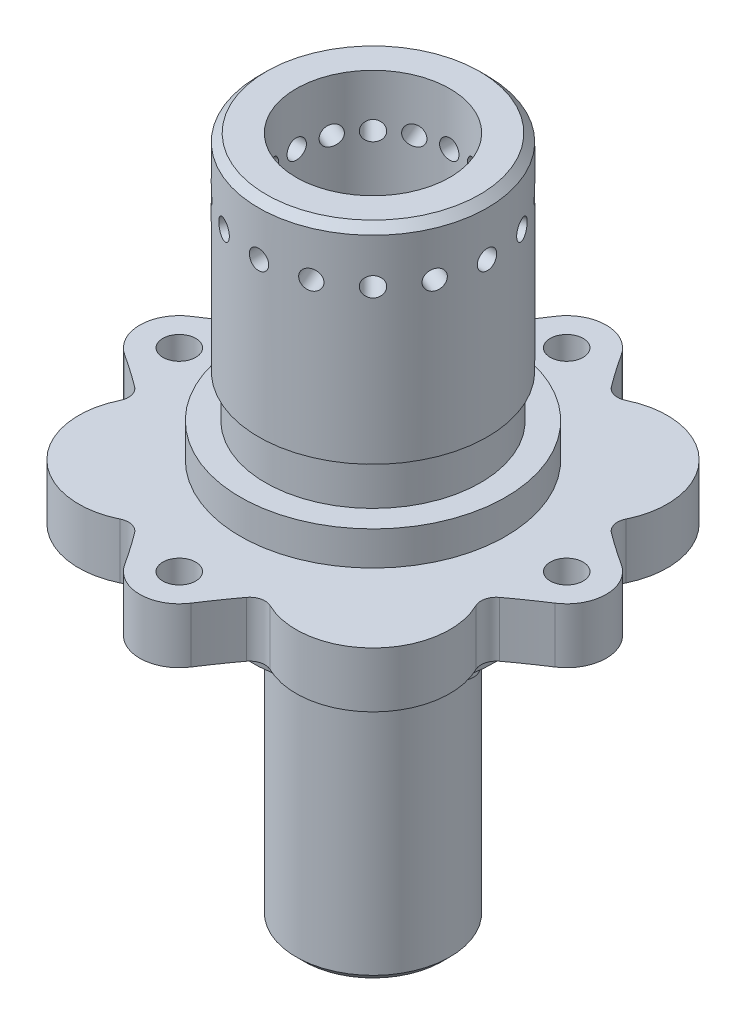
from build123d import *

# Parameters (mm, degrees)
SKETCH5_W                     = 15.875
SKETCH5_H                     = 79.375
DRIVE_PIN_HOLES_D             = 6.8
DRIVE_PIN_HOLES_PATTERN_COUNT = 4
FLANGE_SUPPORT_CUT_REACH      = 104.834
SKETCH8_R                     = 52.5
SKETCH10_R                    = 25.0825
BRAKE_HAT_HEX_DEPTH           = 4.7625
F_5_16_CLEARANCE_HOLE1_D      = 8.4328
SKETCH14_R                    = 2
PIN_HOLES_DEPTH               = 99.496921864
PIN_HOLE_PATTERN_COUNT        = 16
FILLET1_R                     = 3.175
FILLET2_R                     = 3.175


with BuildPart() as part:
    # Sketch1 → Bearing Shaft/Flange Support (revolve)
    with BuildSketch(Plane(origin=(0, 0, 0), x_dir=(0, 0, -1), z_dir=(1, 0, 0)), mode=Mode.PRIVATE) as bearing_shaft_flange_support_sk:
        Polygon((0, 0), (-27.254672075, 0), (-25.0825, -12.319), (-25.0825, -17.0815), (-15.875, -17.0815), (-15.875, -69.56298), (-14.2875, -71.15048), (0, -71.15048), align=None)
    revolve(bearing_shaft_flange_support_sk.sketch.rotate(Axis((0, 0, 0), (0, 1, 0)), 180), axis=Axis((0, 0, 0), (0, 1, 0)))

    # Sketch2 → Drive Pin Support (revolve)
    with BuildSketch(Plane(origin=(0, 0, 0), x_dir=(0, 0, -1), z_dir=(1, 0, 0)), mode=Mode.PRIVATE) as drive_pin_support_sk:
        Polygon((0, 0), (-52.5, 0), (-52.5, 11.43), (-27.4096, 11.43), (-27.4096, 18.43), (-22.225, 18.43), (-22.225, 27.305), (-23.61946, 27.305), (-23.61946, 68.2625), (-22.03196, 69.85), (0, 69.85), align=None)
    revolve(drive_pin_support_sk.sketch.rotate(Axis((0, 0, 0), (0, 1, 0)), 180), axis=Axis((0, 0, 0), (0, 1, 0)))

    # Sketch5 → Center Mass Removal (revolve, cut)
    with BuildSketch(Plane(origin=(0, 0, 0), x_dir=(0, 0, -1), z_dir=(1, 0, 0)), mode=Mode.PRIVATE) as center_mass_removal_sk:
        with Locations((7.9375, 30.1625)):
            Rectangle(SKETCH5_W, SKETCH5_H)
    revolve(center_mass_removal_sk.sketch.rotate(Axis((0, 0, 0), (0, -1, 0)), 180), axis=Axis((0, 0, 0), (0, -1, 0)), mode=Mode.SUBTRACT)

    # Drive Pin Holes (through all)
    with Locations(Plane(origin=(0, 0, 0), x_dir=(-1, 0, 0), z_dir=(0, -1, 0))):
        with Locations((0, -40)):
            drive_pin_holes = Hole(DRIVE_PIN_HOLES_D / 2)

    # Drive Pin Holes Pattern: Drive Pin Holes ×4 about axis
    drive_pin_holes_pattern_axis = Axis((0, 0, 0), (0, 1, 0))
    for i in range(1, DRIVE_PIN_HOLES_PATTERN_COUNT):
        add(drive_pin_holes.rotate(drive_pin_holes_pattern_axis, i * 360 / DRIVE_PIN_HOLES_PATTERN_COUNT), mode=Mode.SUBTRACT)

    # Sketch8 → Flange Support Cut (cut, up to next)
    with BuildSketch(Plane.XZ, mode=Mode.PRIVATE) as flange_support_cut_sk1:
        Circle(SKETCH8_R)
        with BuildLine():
            ThreePointArc((6.851776468, 44.436165629), (0, 48.1625), (-6.851776468, 44.436165629))
            ThreePointArc((-6.851776468, 44.436165629), (-9.964767607, 39.850591878), (-13.274865482, 35.405206349))
            ThreePointArc((-13.274865482, 35.405206349), (-33.675960454, 33.675960454), (-35.405206349, 13.274865482))
            ThreePointArc((-35.405206349, 13.274865482), (-39.850591878, 9.964767607), (-44.436165629, 6.851776468))
            ThreePointArc((-44.436165629, 6.851776468), (-48.1625, 0), (-44.436165629, -6.851776468))
            ThreePointArc((-44.436165629, -6.851776468), (-39.850591878, -9.964767607), (-35.405206349, -13.274865482))
            ThreePointArc((-35.405206349, -13.274865482), (-33.675960454, -33.675960454), (-13.274865482, -35.405206349))
            ThreePointArc((-13.274865482, -35.405206349), (-9.964767607, -39.850591878), (-6.851776468, -44.436165629))
            ThreePointArc((-6.851776468, -44.436165629), (0, -48.1625), (6.851776468, -44.436165629))
            ThreePointArc((6.851776468, -44.436165629), (9.964767607, -39.850591878), (13.274865482, -35.405206349))
            ThreePointArc((13.274865482, -35.405206349), (33.675960454, -33.675960454), (35.405206349, -13.274865482))
            ThreePointArc((35.405206349, -13.274865482), (39.850591878, -9.964767607), (44.436165629, -6.851776468))
            ThreePointArc((44.436165629, -6.851776468), (48.1625, 0), (44.436165629, 6.851776468))
            ThreePointArc((44.436165629, 6.851776468), (39.850591878, 9.964767607), (35.405206349, 13.274865482))
            ThreePointArc((35.405206349, 13.274865482), (33.675960454, 33.675960454), (13.274865482, 35.405206349))
            ThreePointArc((13.274865482, 35.405206349), (9.964767607, 39.850591878), (6.851776468, 44.436165629))
        make_face(mode=Mode.SUBTRACT)
    flange_support_cut_tool1 = extrude(flange_support_cut_sk1.sketch, amount=-FLANGE_SUPPORT_CUT_REACH, mode=Mode.PRIVATE) & part.part
    add(flange_support_cut_tool1.solids().sort_by_distance((-51.015076, 0, 0))[0], mode=Mode.SUBTRACT)

    # Sketch10 → Brake Hat Hex (cut)
    with BuildSketch(Plane.XZ.offset(17.0815)):
        Circle(SKETCH10_R)
        Polygon((10.631905207, -18.415), (21.263810414, 0), (10.631905207, 18.415), (-10.631905207, 18.415), (-21.263810414, 0), (-10.631905207, -18.415), align=None, mode=Mode.SUBTRACT)
    extrude(amount=-BRAKE_HAT_HEX_DEPTH, mode=Mode.SUBTRACT)

    # 5/16 Clearance Hole1 (through all)
    with Locations(Plane(origin=(0, -71.15048, 0), x_dir=(-1, 0, 0), z_dir=(0, -1, 0))):
        with Locations((0, 0)):
            Hole(F_5_16_CLEARANCE_HOLE1_D / 2)

    # Sketch14 → Pin Holes (cut, through all)
    with BuildSketch(Plane(origin=(0, 0, 0), x_dir=(0, 0, -1), z_dir=(1, 0, 0))):
        with Locations((0, 59.05)):
            Circle(SKETCH14_R)
    pin_holes = extrude(amount=-PIN_HOLES_DEPTH, mode=Mode.SUBTRACT)

    # Pin Hole Pattern: Pin Holes ×16 about axis
    pin_hole_pattern_axis = Axis((0, 0, 0), (0, -1, 0))
    for i in range(1, PIN_HOLE_PATTERN_COUNT):
        add(pin_holes.rotate(pin_hole_pattern_axis, i * 360 / PIN_HOLE_PATTERN_COUNT), mode=Mode.SUBTRACT)

    # Fillet1
    fillet1_edges = [part.edges().sort_by_distance(p)[0] for p in [
        (-35.405206349, 5.715, -13.274865482),
        (-13.274865482, 5.715, -35.405206349),
        (13.274865482, 5.715, -35.405206349),
        (35.405206349, 5.715, -13.274865482),
        (35.405206349, 5.715, 13.274865482),
        (13.274865482, 5.715, 35.405206349),
        (-13.274865482, 5.715, 35.405206349),
        (-35.405206349, 5.715, 13.274865482),
    ]]
    fillet(fillet1_edges, radius=FILLET1_R)

    # Fillet2
    fillet2_edges = [part.edges().sort_by_distance(p)[0] for p in [
        (-10.631905207, -14.70025, -18.415),
        (-21.263810414, -14.70025, 0),
        (-10.631905207, -14.70025, 18.415),
        (10.631905207, -14.70025, 18.415),
        (21.263810414, -14.70025, 0),
        (10.631905207, -14.70025, -18.415),
    ]]
    fillet(fillet2_edges, radius=FILLET2_R)


solid = part.part
